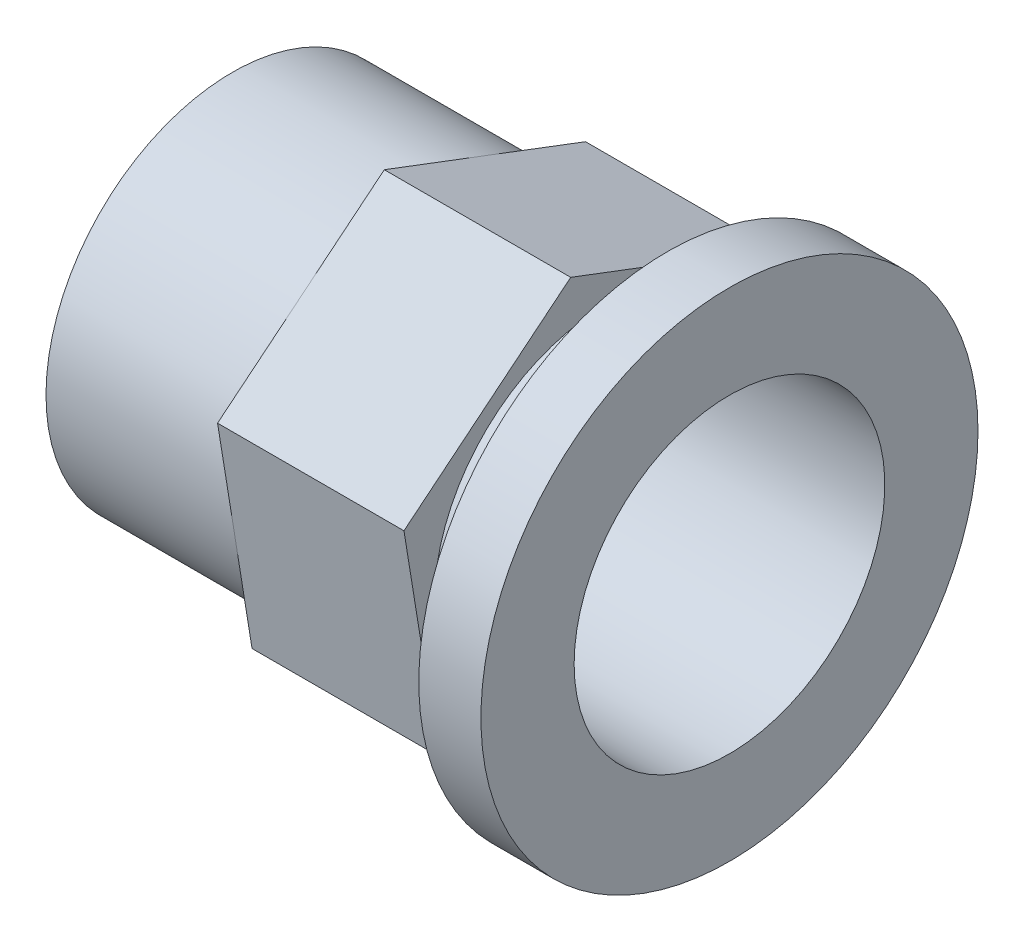
from build123d import *

# Parameters (mm, degrees)
SKETCH_1_R          = 3
EXTRUDE_1_DEPTH     = 3
EXTRUDE_2_DEPTH     = 3
SKETCH_3_R          = 2.75
EXTRUDE_3_DEPTH     = 1
SKETCH_4_R          = 4
EXTRUDE_4_DEPTH     = 1
SKETCH_5_R          = 2.5
CUT_EXTRUDE_1_DEPTH = 10.797958971


with BuildPart() as part:
    # 草图1 → 凸台-拉伸1 (new body)
    with BuildSketch(Plane(origin=(0, 0, 0), x_dir=(0, 0, -1), z_dir=(1, 0, 0))):
        Circle(SKETCH_1_R)
    extrude(amount=EXTRUDE_1_DEPTH)

    # 草图2 → 凸台-拉伸2 (add)
    with BuildSketch(Plane(origin=(3, 0, 0), x_dir=(0, 0, -1), z_dir=(1, 0, 0))):
        Polygon((3.238836652, -1.228794996), (2.683586009, 2.190517321), (-0.555250643, 3.419312317), (-3.238836652, 1.228794996), (-2.683586009, -2.190517321), (0.555250643, -3.419312317), align=None)
    extrude(amount=EXTRUDE_2_DEPTH)

    # 草图3 → 凸台-拉伸3 (add)
    with BuildSketch(Plane(origin=(6, 0, 0), x_dir=(0, 0, -1), z_dir=(1, 0, 0))):
        Circle(SKETCH_3_R)
    extrude(amount=EXTRUDE_3_DEPTH)

    # 草图4 → 凸台-拉伸4 (add)
    with BuildSketch(Plane(origin=(7, 0, 0), x_dir=(0, 0, -1), z_dir=(1, 0, 0))):
        Circle(SKETCH_4_R)
    extrude(amount=EXTRUDE_4_DEPTH)

    # 草图5 → 切除-拉伸1 (cut, through all)
    with BuildSketch(Plane.ZY):
        Circle(SKETCH_5_R)
    extrude(amount=-CUT_EXTRUDE_1_DEPTH, mode=Mode.SUBTRACT)


solid = part.part
